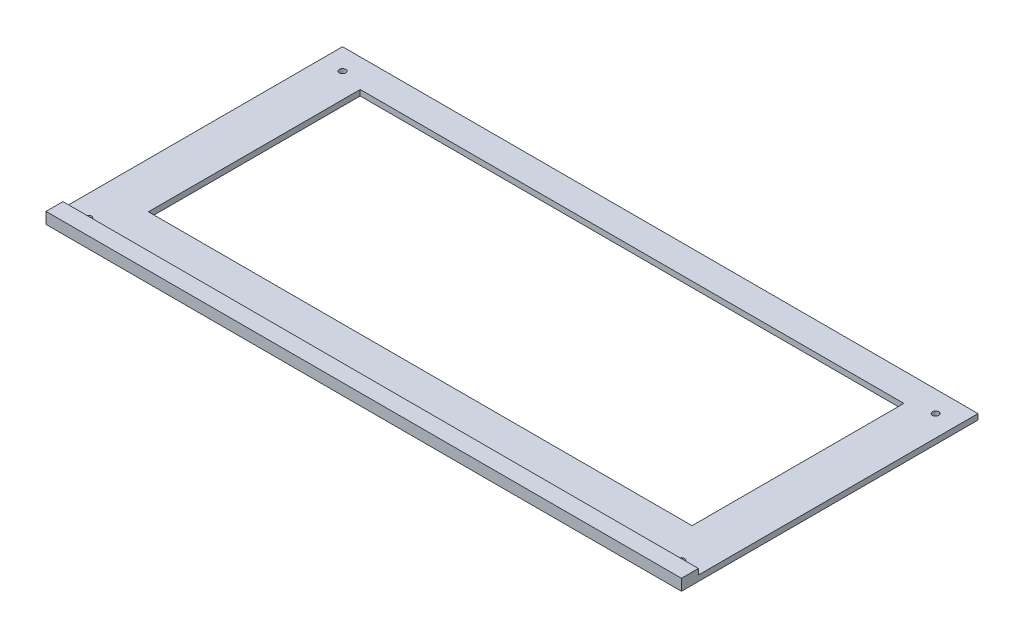
from build123d import *

# Parameters (mm, degrees)
F_01_GUARD_OUTLINE_W      = 900
F_01_GUARD_OUTLINE_H      = 420
F_01_GUARD_OUTLINE_R      = 4.5
F_01_GUARD_OUTLINE_W_2    = 770
F_01_GUARD_OUTLINE_H_2    = 300
F_01_GUARD_PANEL_DEPTH    = 8
F_02_FRAME_RAIL_PROFILE_W = 900
F_02_FRAME_RAIL_PROFILE_H = 24
F_02_FRAME_RAIL_DEPTH     = 16


with BuildPart() as part:
    # 01_Guard_Outline → 01_Guard_Panel (new body)
    with BuildSketch(Plane(origin=(0, 0, 0), x_dir=(1, 0, 0), z_dir=(0, 1, 0))):
        Rectangle(F_01_GUARD_OUTLINE_W, F_01_GUARD_OUTLINE_H)
        with Locations(Location((-420, -180, 0), (0, 0, 270))):
            Circle(F_01_GUARD_OUTLINE_R, mode=Mode.SUBTRACT)
        with Locations(Location((420, -180, 0), (0, 0, 270))):
            Circle(F_01_GUARD_OUTLINE_R, mode=Mode.SUBTRACT)
        with Locations(Location((-420, 180, 0), (0, 0, 270))):
            Circle(F_01_GUARD_OUTLINE_R, mode=Mode.SUBTRACT)
        with Locations(Location((420, 180, 0), (0, 0, 270))):
            Circle(F_01_GUARD_OUTLINE_R, mode=Mode.SUBTRACT)
        with Locations((0, 20)):
            Rectangle(F_01_GUARD_OUTLINE_W_2, F_01_GUARD_OUTLINE_H_2, mode=Mode.SUBTRACT)
    extrude(amount=F_01_GUARD_PANEL_DEPTH)

    # 02_Frame_Rail_Profile → 02_Frame_Rail (add)
    with BuildSketch(Plane(origin=(0, 0, 0), x_dir=(1, 0, 0), z_dir=(0, 1, 0))):
        with Locations((0, -198)):
            Rectangle(F_02_FRAME_RAIL_PROFILE_W, F_02_FRAME_RAIL_PROFILE_H)
    extrude(amount=F_02_FRAME_RAIL_DEPTH)


solid = part.part
